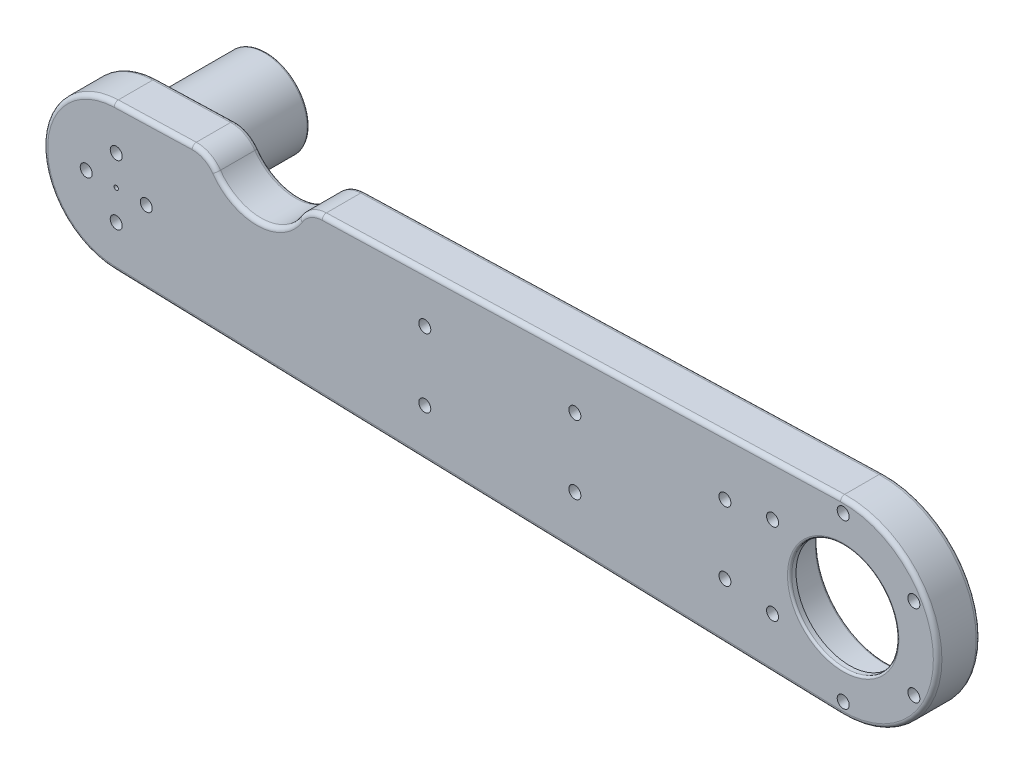
from build123d import *

# Parameters (mm, degrees)
BOSS_EXTRUDE1_DEPTH      = 5
BOSS_EXTRUDE1_DEPTH_BACK = 5
SKETCH1_R                = 16.025
SKETCH1_R_2              = 0.5
SKETCH3_R                = 1.4
CUT_EXTRUDE1_DEPTH       = 115.521930869
SKETCH4_R                = 1.4
CUT_EXTRUDE2_DEPTH       = 112.871679392
BOSS_EXTRUDE2_START      = -1.5
SKETCH5_R                = 16.025
SKETCH5_R_2              = 12.5
BOSS_EXTRUDE2_DEPTH      = 1.5
FEMURCUTOUT_DEPTH        = 115.521930869
FILLET1_R                = 1
FILLET2_R                = 0.5
FILLET3_R                = 0.5
SKETCH9_R                = 1.4
CUT_EXTRUDE3_DEPTH       = 112.871679412


with BuildPart() as part:
    # Sketch1 → Boss-Extrude1 (new, two sides: drawn at the far end of the back side and taken through both)
    with BuildSketch(Plane.XY.offset(-BOSS_EXTRUDE1_DEPTH_BACK)):
        with BuildLine():
            Line((-85.273863395, 16.99253135), (84.117200513, 22.015323705))
            ThreePointArc((84.117200513, 22.015323705), (106.795, 0), (84.117200513, -22.015323705))
            Line((84.117200513, -22.015323705), (-85.273863395, -16.99253135))
            ThreePointArc((-85.273863395, -16.99253135), (-101.77, 0), (-85.273863395, 16.99253135))
        make_face()
        with Locations((84.77, 0)):
            Circle(SKETCH1_R, mode=Mode.SUBTRACT)
        with Locations((-84.77, 0)):
            Circle(SKETCH1_R_2, mode=Mode.SUBTRACT)
    extrude(amount=BOSS_EXTRUDE1_DEPTH + BOSS_EXTRUDE1_DEPTH_BACK)

    # Sketch2 → Revolve1 (revolve)
    with BuildSketch(Plane(origin=(0, 0, 0), x_dir=(1, 0, 0), z_dir=(0, 1, 0))):
        Polygon((-84.77, 30), (-74.745, 30), (-74.745, 7), (-73.27, 7), (-71.27, 5), (-84.77, 5), align=None)
    revolve(axis=Axis((-84.77, 0, -5), (0, 0, -1)))

    # Sketch3 → Cut-Extrude1 (cut, through all)
    with BuildSketch(Plane(origin=(0, 0, -30), x_dir=(-1, 0, 0), z_dir=(0, 0, -1))):
        with Locations((84.77, 7)):
            Circle(SKETCH3_R)
        with Locations((91.77, 0)):
            Circle(SKETCH3_R)
        with Locations((84.77, -7)):
            Circle(SKETCH3_R)
        with Locations((77.77, 0)):
            Circle(SKETCH3_R)
    extrude(amount=-CUT_EXTRUDE1_DEPTH, mode=Mode.SUBTRACT)

    # Sketch4 → Cut-Extrude2 (cut, through all)
    with BuildSketch(Plane(origin=(0, 0, -5), x_dir=(-1, 0, 0), z_dir=(0, 0, -1))):
        with Locations((-84.77, 19.025)):
            Circle(SKETCH4_R)
        with Locations((-68.293866693, 9.5125)):
            Circle(SKETCH4_R)
        with Locations((-68.293866693, -9.5125)):
            Circle(SKETCH4_R)
        with Locations((-84.77, -19.025)):
            Circle(SKETCH4_R)
        with Locations((-101.246133307, -9.5125)):
            Circle(SKETCH4_R)
        with Locations((-101.246133307, 9.5125)):
            Circle(SKETCH4_R)
    extrude(amount=-CUT_EXTRUDE2_DEPTH, mode=Mode.SUBTRACT)

    # Sketch5 → Boss-Extrude2 (add)
    with BuildSketch(Plane.XY.offset(5).offset(BOSS_EXTRUDE2_START)):
        with Locations((84.77, 0)):
            Circle(SKETCH5_R)
        with Locations((84.77, 0)):
            Circle(SKETCH5_R_2, mode=Mode.SUBTRACT)
    extrude(amount=BOSS_EXTRUDE2_DEPTH)

    # Sketch6 → FemurCutout (cut, through all)
    with BuildSketch(Plane.XY.offset(5)):
        with BuildLine():
            Line((-67.086804522, 17.531814935), (-36.757577924, 18.431138689))
            ThreePointArc((-36.757577924, 18.431138689), (-39.887207212, 17.539998228), (-42.21669011, 15.267946244))
            ThreePointArc((-42.21669011, 15.267946244), (-51.679151233, 9.785079338), (-61.449858197, 14.697643375))
            ThreePointArc((-61.449858197, 14.697643375), (-63.909871959, 16.827676964), (-67.086804522, 17.531814935))
        make_face()
    extrude(amount=-FEMURCUTOUT_DEPTH, mode=Mode.SUBTRACT)

    # Fillet1
    fillet1_edges = [part.edges().sort_by_distance(p)[0] for p in [
        (-101.77, 0, 5),
        (-76.180333959, 17.262173143, 5),
        (23.679811294, 20.223231197, 5),
        (106.795, 0, 5),
        (106.795, 0, -5),
        (-0.578331441, -19.503927527, -5),
        (-101.77, 0, -5),
        (-0.578331441, -19.503927527, 5),
        (23.679811294, 20.223231197, -5),
        (-76.180333959, 17.262173143, -5),
        (-63.909871959, 16.827676964, 5),
        (-51.679151233, 9.785079338, 5),
        (-39.887207212, 17.539998228, 5),
        (-63.909871959, 16.827676964, -5),
        (-51.679151233, 9.785079338, -5),
        (-39.887207212, 17.539998228, -5),
    ]]
    fillet(fillet1_edges, radius=FILLET1_R)

    # Fillet2
    fillet2_edges = [part.edges().sort_by_distance(p)[0] for p in [
        (68.745, 0, -5),
        (-94.795, 0, -30),
    ]]
    fillet(fillet2_edges, radius=FILLET2_R)

    # Fillet3
    fillet3_edges = [part.edges().sort_by_distance(p)[0] for p in [
        (72.27, 0, 5),
    ]]
    fillet(fillet3_edges, radius=FILLET3_R)

    # Sketch9 → Cut-Extrude3 (cut, through all)
    with BuildSketch(Plane(origin=(0, 0, -5), x_dir=(-1, 0, 0), z_dir=(0, 0, -1))):
        with Locations((-22.185248409, -8)):
            Circle(SKETCH9_R)
        with Locations((-22.185248409, 8)):
            Circle(SKETCH9_R)
        with Locations((-57.185248409, 8)):
            Circle(SKETCH9_R)
        with Locations((-57.185248409, -8)):
            Circle(SKETCH9_R)
        with Locations((12.814751591, -8)):
            Circle(SKETCH9_R)
        with Locations((12.814751591, 8)):
            Circle(SKETCH9_R)
    extrude(amount=-CUT_EXTRUDE3_DEPTH, mode=Mode.SUBTRACT)


solid = part.part
